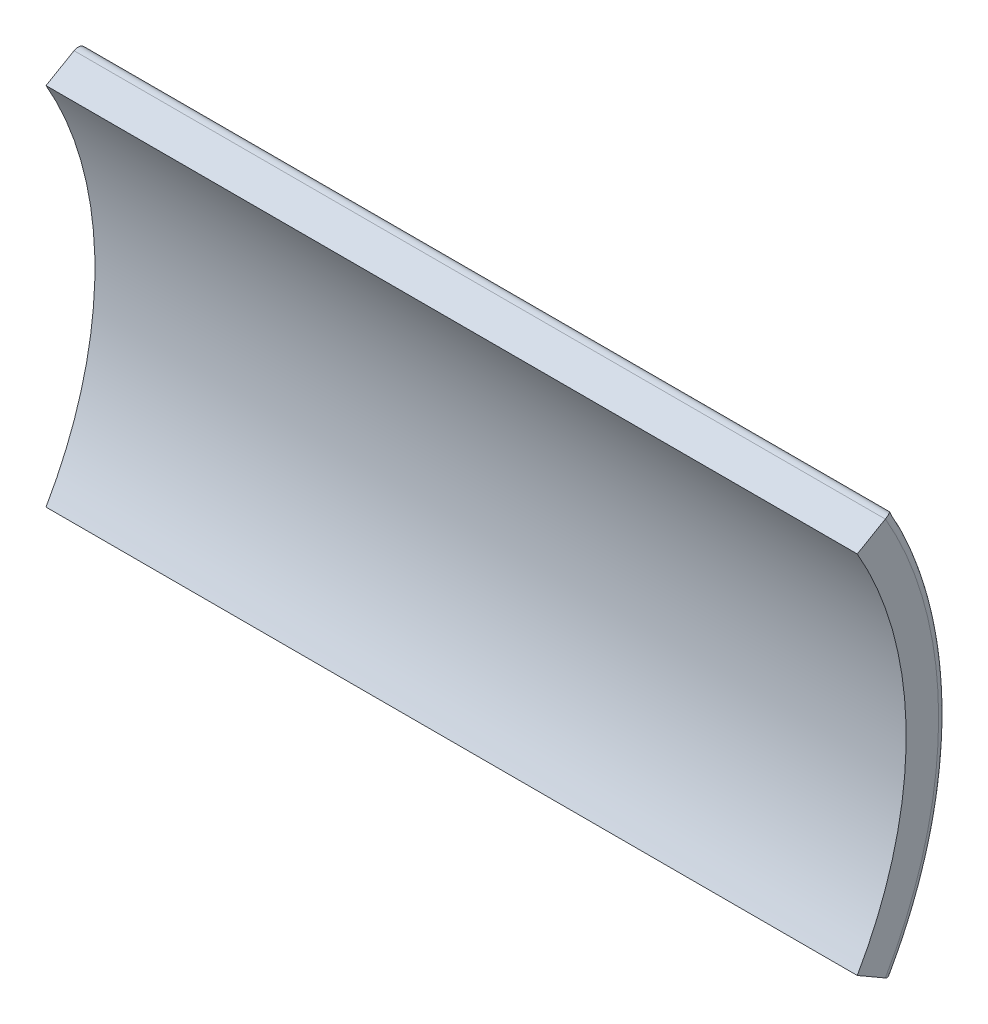
from build123d import *

# Parameters (mm, degrees)
BOSS_EXTRUDE1_DEPTH = 10
FILLET3_R           = 0.1


with BuildPart() as part:
    # airflap → Boss-Extrude1 (new body)
    with BuildSketch(Plane(origin=(0, 0, 0), x_dir=(0, 0, -1), z_dir=(1, 0, 0))):
        with BuildLine():
            Line((3.897114317, 2.25), (4.330127019, 2.5))
            ThreePointArc((4.330127019, 2.5), (5, 0), (4.330127019, -2.5))
            Line((4.330127019, -2.5), (3.897114317, -2.25))
            ThreePointArc((3.897114317, -2.25), (4.5, 0), (3.897114317, 2.25))
        make_face()
    extrude(amount=BOSS_EXTRUDE1_DEPTH)

    # Fillet3
    fillet3_edges = [part.edges().sort_by_distance(p)[0] for p in [
        (10, 0, -5),
        (5, 2.5, -4.330127019),
        (5, -2.5, -4.330127019),
    ]]
    fillet(fillet3_edges, radius=FILLET3_R)


solid = part.part
